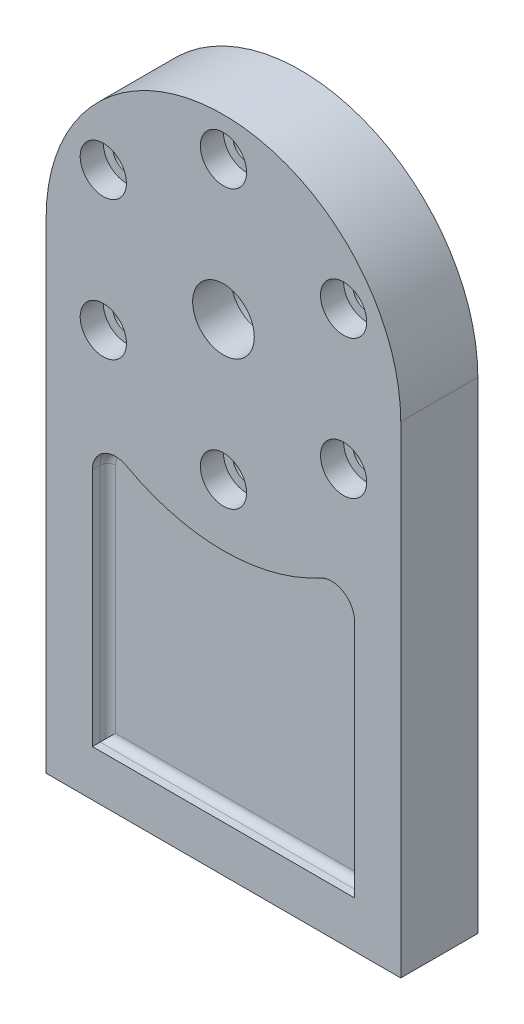
from build123d import *

# Parameters (mm, degrees)
SKETCH1_R                               = 8
BOSS_EXTRUDE1_DEPTH                     = 10
SKETCH2_R                               = 12.5
CUT_EXTRUDE1_DEPTH                      = 10
SKETCH4_R                               = 3.5
CUT_EXTRUDE2_DEPTH                      = 179.204938203
SKETCH5_R                               = 6
CUT_EXTRUDE3_DEPTH                      = 6
CIRPATTERN1_COUNT                       = 6
TAP_DRILL_FOR_M10X1_25_TAP1_D           = 8.8
TAP_DRILL_FOR_M10X1_25_TAP1_DEPTH       = 24
TAP_DRILL_FOR_M10X1_25_TAP1_CSINK_D     = 8.85
TAP_DRILL_FOR_M10X1_25_TAP1_CSINK_ANGLE = 90
TAP_DRILL_FOR_M10X1_25_TAP1_TIP         = 2.643786724
CUT_EXTRUDE4_DEPTH                      = 4
FILLET1_R                               = 2
FILLET1_OF_MIRROR1_R                    = 2


with BuildPart() as part:
    # Sketch1 → Boss-Extrude1 (new, symmetric)
    with BuildSketch(Plane.XY):
        with BuildLine():
            Line((46, 125), (46, 0))
            Line((46, 0), (0, 0))
            Line((0, 0), (-46, 0))
            Line((-46, 0), (-46, 125))
            ThreePointArc((-46, 125), (0, 171), (46, 125))
        make_face()
        with Locations((0, 125)):
            Circle(SKETCH1_R, mode=Mode.SUBTRACT)
    extrude(amount=BOSS_EXTRUDE1_DEPTH, both=True)

    # Sketch2 → Cut-Extrude1 (cut)
    with BuildSketch(Plane(origin=(0, 0, -10), x_dir=(-1, 0, 0), z_dir=(0, 0, -1))):
        with Locations((0, 125)):
            Circle(SKETCH2_R)
    extrude(amount=-CUT_EXTRUDE1_DEPTH, mode=Mode.SUBTRACT)

    # Sketch4 → Cut-Extrude2 (cut, through all)
    with BuildSketch(Plane(origin=(0, 0, -10), x_dir=(-1, 0, 0), z_dir=(0, 0, -1))):
        with Locations((0, 161)):
            Circle(SKETCH4_R)
    cut_extrude2 = extrude(amount=-CUT_EXTRUDE2_DEPTH, mode=Mode.SUBTRACT)

    # Sketch5 → Cut-Extrude3 (cut)
    with BuildSketch(Plane.XY.offset(10)):
        with Locations((0, 161)):
            Circle(SKETCH5_R)
    cut_extrude3 = extrude(amount=-CUT_EXTRUDE3_DEPTH, mode=Mode.SUBTRACT)

    # CirPattern1: Cut-Extrude2, Cut-Extrude3 ×6 about axis
    cirpattern1_axis = Axis((0, 125, 0), (0, 0, 1))
    add([cut_extrude2.rotate(cirpattern1_axis, i * 360 / CIRPATTERN1_COUNT) for i in range(1, CIRPATTERN1_COUNT)], mode=Mode.SUBTRACT)
    add([cut_extrude3.rotate(cirpattern1_axis, i * 360 / CIRPATTERN1_COUNT) for i in range(1, CIRPATTERN1_COUNT)], mode=Mode.SUBTRACT)

    # Tap Drill for M10x1.25 Tap1
    with Locations(Plane(origin=(0, 0, 0), x_dir=(-1, 0, 0), z_dir=(0, -1, 0))):
        with Locations((-30, 0), (30, 0)):
            CounterSinkHole(TAP_DRILL_FOR_M10X1_25_TAP1_D / 2, TAP_DRILL_FOR_M10X1_25_TAP1_CSINK_D / 2, depth=TAP_DRILL_FOR_M10X1_25_TAP1_DEPTH, counter_sink_angle=TAP_DRILL_FOR_M10X1_25_TAP1_CSINK_ANGLE)
            with Locations((0, 0, -(TAP_DRILL_FOR_M10X1_25_TAP1_DEPTH + TAP_DRILL_FOR_M10X1_25_TAP1_TIP / 2))):  # 118° drill point
                Cone(0, TAP_DRILL_FOR_M10X1_25_TAP1_D / 2, TAP_DRILL_FOR_M10X1_25_TAP1_TIP, mode=Mode.SUBTRACT)

    # Sketch9 → Cut-Extrude4 (cut)
    with BuildSketch(Plane(origin=(0, 0, -10), x_dir=(-1, 0, 0), z_dir=(0, 0, -1))):
        with BuildLine():
            Line((-34, 12), (-34, 74.206299603))
            ThreePointArc((-34, 74.206299603), (-31.051285766, 79.372502771), (-25.103448276, 79.460820334))
            ThreePointArc((-25.103448276, 79.460820334), (0, 73), (25.103448276, 79.460820334))
            ThreePointArc((25.103448276, 79.460820334), (31.051285766, 79.372502771), (34, 74.206299603))
            Line((34, 74.206299603), (34, 12))
            Line((34, 12), (-34, 12))
        make_face()
    cut_extrude4 = extrude(amount=-CUT_EXTRUDE4_DEPTH, mode=Mode.SUBTRACT)

    # Fillet1
    fillet1_edges = [part.edges().sort_by_distance(p)[0] for p in [
        (-31.051285766, 79.372502771, -6),
        (-34, 43.103149802, -6),
        (0, 12, -6),
        (34, 43.103149802, -6),
        (31.051285766, 79.372502771, -6),
        (0, 73, -6),
    ]]
    fillet(fillet1_edges, radius=FILLET1_R)

    # Mirror1: Cut-Extrude4 across plane
    add(cut_extrude4.mirror(Plane.XY), mode=Mode.SUBTRACT)

    # Fillet1 of Mirror1
    fillet1_of_mirror1_edges = [part.edges().sort_by_distance(p)[0] for p in [
        (-31.051285766, 79.372502771, 6),
        (-34, 43.103149802, 6),
        (0, 12, 6),
        (34, 43.103149802, 6),
        (31.051285766, 79.372502771, 6),
        (0, 73, 6),
    ]]
    fillet(fillet1_of_mirror1_edges, radius=FILLET1_OF_MIRROR1_R)


solid = part.part
